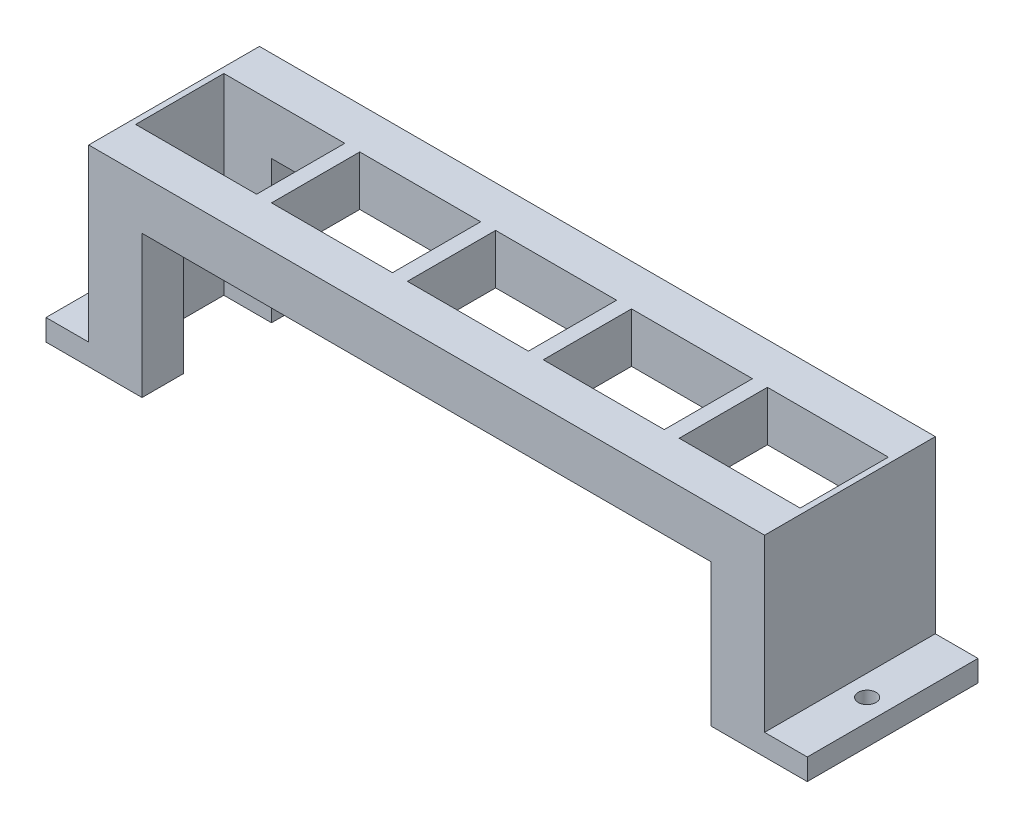
from build123d import *

# Parameters (mm, degrees)
SKETCH1_W           = 95
SKETCH1_H           = 24
BOSS_EXTRUDE1_DEPTH = 27
SKETCH2_W           = 17
SKETCH2_H           = 12.4
CUT_EXTRUDE1_DEPTH  = 56.939699677
SKETCH3_W           = 80
SKETCH3_H           = 44.068449986
CUT_EXTRUDE2_DEPTH  = 20
SKETCH4_W           = 24
SKETCH4_H           = 3
BOSS_EXTRUDE2_DEPTH = 6
SKETCH5_W           = 24
SKETCH5_H           = 3
BOSS_EXTRUDE3_DEPTH = 6
SKETCH6_R           = 1.25
CUT_EXTRUDE3_DEPTH  = 60.851900555
SKETCH7_R           = 1.25
CUT_EXTRUDE4_DEPTH  = 60.851900555


with BuildPart() as part:
    # Sketch1 → Boss-Extrude1 (new body)
    with BuildSketch(Plane(origin=(0, 0, 0), x_dir=(1, 0, 0), z_dir=(0, 1, 0))):
        Rectangle(SKETCH1_W, SKETCH1_H)
    extrude(amount=BOSS_EXTRUDE1_DEPTH)

    # Sketch2 → Cut-Extrude1 (cut, through all)
    with BuildSketch(Plane(origin=(0, 27, 0), x_dir=(1, 0, 0), z_dir=(0, 1, 0))):
        with Locations((19.1, 0)):
            Rectangle(SKETCH2_W, SKETCH2_H)
        Rectangle(SKETCH2_W, SKETCH2_H)
        with Locations((-19.1, 0)):
            Rectangle(SKETCH2_W, SKETCH2_H)
        with Locations((-38.2, 0)):
            Rectangle(SKETCH2_W, SKETCH2_H)
        with Locations((38.2, 0)):
            Rectangle(SKETCH2_W, SKETCH2_H)
    extrude(amount=-CUT_EXTRUDE1_DEPTH, mode=Mode.SUBTRACT)

    # Sketch3 → Cut-Extrude2 (cut)
    with BuildSketch(Plane.XZ):
        Rectangle(SKETCH3_W, SKETCH3_H)
    extrude(amount=-CUT_EXTRUDE2_DEPTH, mode=Mode.SUBTRACT)

    # Sketch4 → Boss-Extrude2 (add)
    with BuildSketch(Plane(origin=(47.5, 0, 0), x_dir=(0, 0, -1), z_dir=(1, 0, 0))):
        with Locations((0, 1.5)):
            Rectangle(SKETCH4_W, SKETCH4_H)
    extrude(amount=BOSS_EXTRUDE2_DEPTH)

    # Sketch5 → Boss-Extrude3 (add)
    with BuildSketch(Plane.ZY.offset(47.5)):
        with Locations((0, 1.5)):
            Rectangle(SKETCH5_W, SKETCH5_H)
    extrude(amount=BOSS_EXTRUDE3_DEPTH)

    # Sketch6 → Cut-Extrude3 (cut, through all)
    with BuildSketch(Plane(origin=(0, 3, 0), x_dir=(1, 0, 0), z_dir=(0, 1, 0))):
        with Locations(Location((50.45345714, -0.537948729, 0), (0, 0, 270))):
            Circle(SKETCH6_R)
    extrude(amount=-CUT_EXTRUDE3_DEPTH, mode=Mode.SUBTRACT)

    # Sketch7 → Cut-Extrude4 (cut, through all)
    with BuildSketch(Plane(origin=(0, 3, 0), x_dir=(1, 0, 0), z_dir=(0, 1, 0))):
        with Locations(Location((-50.910758479, 0.436684104, 0), (0, 0, 270))):
            Circle(SKETCH7_R)
    extrude(amount=-CUT_EXTRUDE4_DEPTH, mode=Mode.SUBTRACT)


solid = part.part
